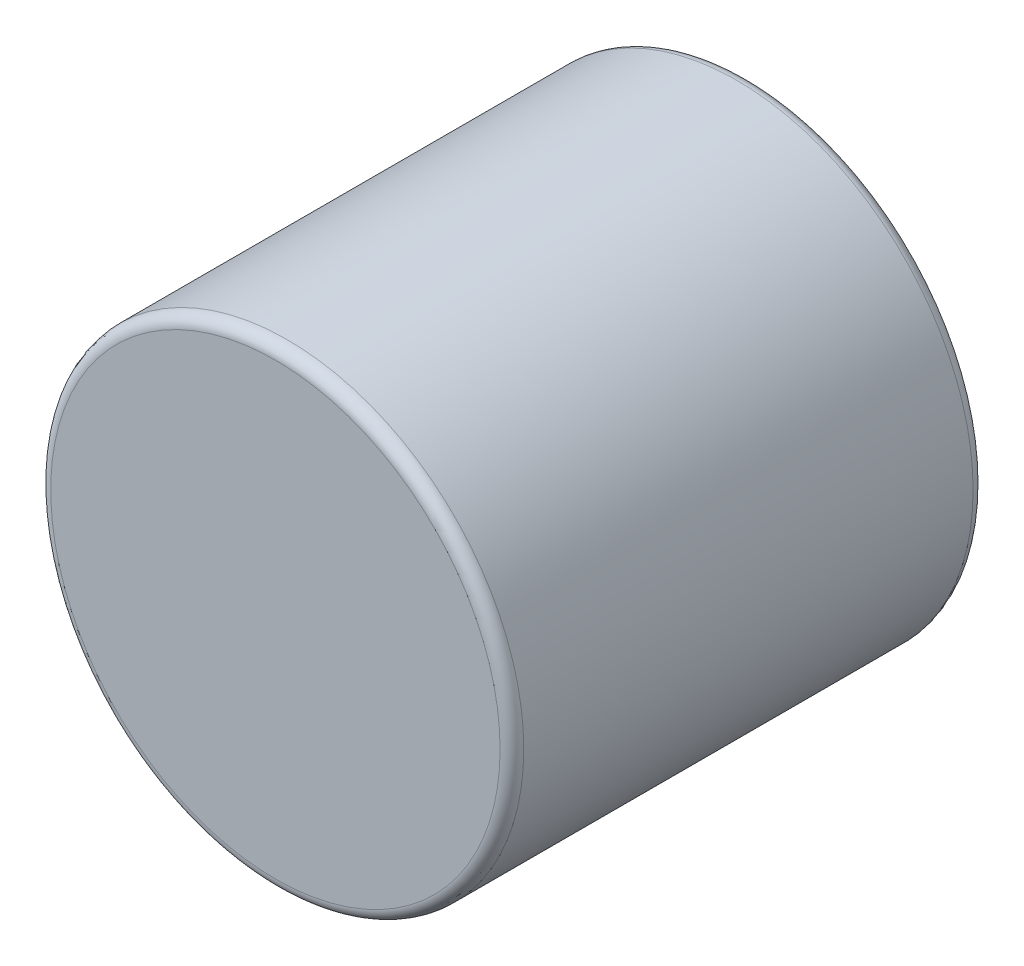
from build123d import *

# Parameters (mm, degrees)
BOSS_EXTRUDE1_DEPTH      = 3.175
BOSS_EXTRUDE1_DEPTH_BACK = 3.175
SKETCH3_R                = 3.175
FILLET1_R                = 0.15875


with BuildPart() as part:
    # Sketch3 → Boss-Extrude1 (new, two sides: drawn at the far end of the back side and taken through both)
    with BuildSketch(Plane.XY.offset(-BOSS_EXTRUDE1_DEPTH_BACK)):
        Circle(SKETCH3_R)
    extrude(amount=BOSS_EXTRUDE1_DEPTH + BOSS_EXTRUDE1_DEPTH_BACK)

    # Fillet1
    fillet1_edges = [part.edges().sort_by_distance(p)[0] for p in [
        (-3.175, 0, -3.175),
        (-3.175, 0, 3.175),
    ]]
    fillet(fillet1_edges, radius=FILLET1_R)


solid = part.part
